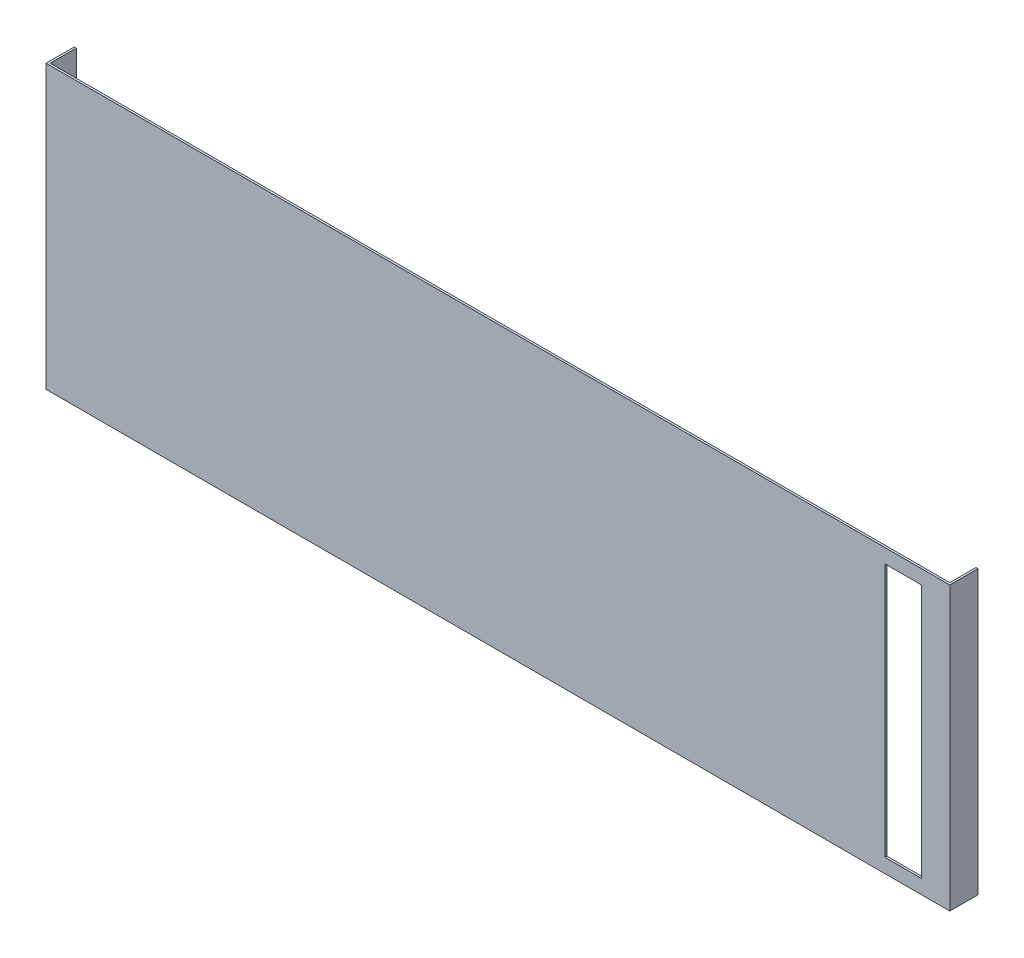
from build123d import *

# Parameters (mm, degrees)
OVEN_PANO_KAPAGI_KAPAK_1_START = 120
OVEN_PANO_KAPAGI_KAPAK_1_DEPTH = 200
OVEN_PANO_KAPAGI_KAPAK_2_START = 27
SKETCH2_W                      = 26
SKETCH2_H                      = 180
OVEN_PANO_KAPAGI_KAPAK_2_DEPTH = 14


with BuildPart() as part:
    # Sketch1 → OVEN_pano_kapagi_kapak_1 (new body)
    with BuildSketch(Plane(origin=(0, 0, 0), x_dir=(1, 0, 0), z_dir=(0, 1, 0)).offset(OVEN_PANO_KAPAGI_KAPAK_1_START)):
        Polygon((30, -40), (30, -20), (31.5, -20), (31.5, -38.5), (668.5, -38.5), (668.5, -20), (670, -20), (670, -40), align=None)
    extrude(amount=OVEN_PANO_KAPAGI_KAPAK_1_DEPTH)

    # Sketch2 → OVEN_pano_kapagi_kapak_2 (cut)
    with BuildSketch(Plane.XY.offset(OVEN_PANO_KAPAGI_KAPAK_2_START)):
        with Locations((637, 220)):
            Rectangle(SKETCH2_W, SKETCH2_H)
    extrude(amount=OVEN_PANO_KAPAGI_KAPAK_2_DEPTH, mode=Mode.SUBTRACT)


solid = part.part
